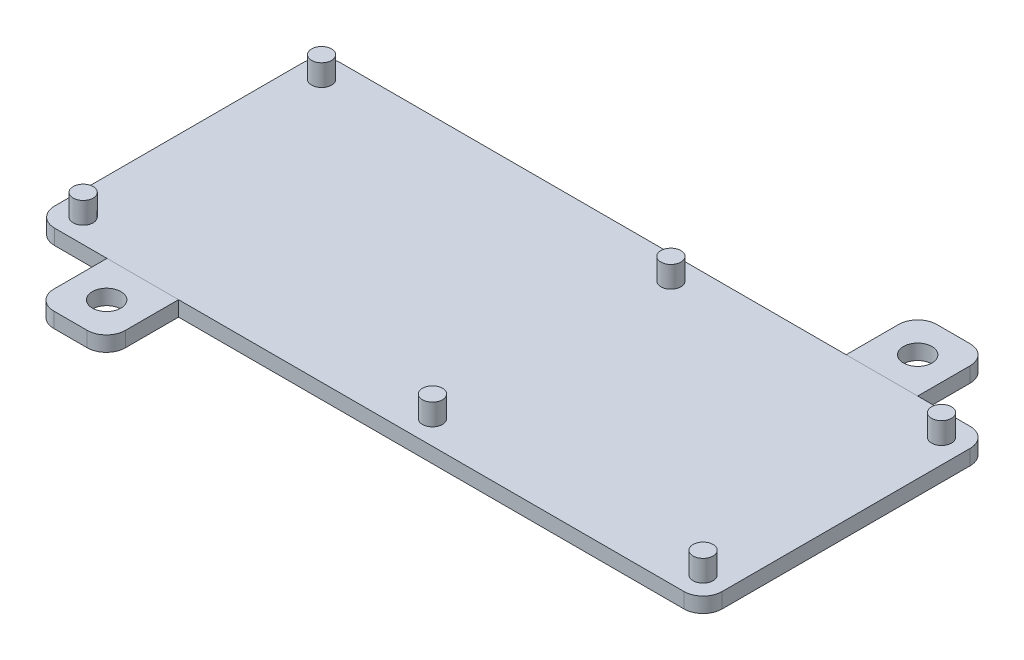
from build123d import *

# Parameters (mm, degrees)
SKETCH1_R             = 2.0955
BOSS_EXTRUDE1_DEPTH   = 4.5
BOSS_EXTRUDE1_2_DEPTH = 4.5
BOSS_EXTRUDE1_3_DEPTH = 4.5
BOSS_EXTRUDE1_4_DEPTH = 4.5
BOSS_EXTRUDE1_5_DEPTH = 4.5
BOSS_EXTRUDE1_6_DEPTH = 4.5
SKETCH2_W             = 140
SKETCH2_H             = 60
BOSS_EXTRUDE2_DEPTH   = 3.175
FILLET1_R             = 4
SKETCH3_W             = 15
SKETCH3_H             = 15.144108324
SKETCH3_R             = 3
BOSS_EXTRUDE3_DEPTH   = 3.175
SKETCH3_H_2           = 15
BOSS_EXTRUDE3_2_DEPTH = 3.175
FILLET2_R             = 4
FILLET3_R             = 4


with BuildPart() as part:
    # Sketch1 → Boss-Extrude1 (new body)
    with BuildSketch(Plane.XZ.offset(38.063324544)):
        with Locations(Location((-181.839905385, -5.726884341, 0), (0, 0, 270))):
            Circle(SKETCH1_R)
    extrude(amount=BOSS_EXTRUDE1_DEPTH)



with BuildPart() as body_2:
    # Sketch1 → Boss-Extrude1 2 (new body)
    with BuildSketch(Plane.XZ.offset(38.063324544)):
        with Locations(Location((-108.589905385, -5.726884341, 0), (0, 0, 270))):
            Circle(SKETCH1_R)
    extrude(amount=BOSS_EXTRUDE1_2_DEPTH)


with BuildPart() as body_3:
    # Sketch1 → Boss-Extrude1 3 (new body)
    with BuildSketch(Plane.XZ.offset(38.063324544)):
        with Locations(Location((-51.839905385, -5.726884341, 0), (0, 0, 270))):
            Circle(SKETCH1_R)
    extrude(amount=BOSS_EXTRUDE1_3_DEPTH)


with BuildPart() as body_4:
    # Sketch1 → Boss-Extrude1 4 (new body)
    with BuildSketch(Plane.XZ.offset(38.063324544)):
        with Locations(Location((-51.839905385, 44.273115659, 0), (0, 0, 270))):
            Circle(SKETCH1_R)
    extrude(amount=BOSS_EXTRUDE1_4_DEPTH)


with BuildPart() as body_5:
    # Sketch1 → Boss-Extrude1 5 (new body)
    with BuildSketch(Plane.XZ.offset(38.063324544)):
        with Locations(Location((-108.589905385, 44.273115659, 0), (0, 0, 270))):
            Circle(SKETCH1_R)
    extrude(amount=BOSS_EXTRUDE1_5_DEPTH)


with BuildPart() as body_6:
    # Sketch1 → Boss-Extrude1 6 (new body)
    with BuildSketch(Plane.XZ.offset(38.063324544)):
        with Locations(Location((-181.839905385, 44.273115659, 0), (0, 0, 270))):
            Circle(SKETCH1_R)
    extrude(amount=BOSS_EXTRUDE1_6_DEPTH)


with BuildPart() as part_1:
    add(part.part)

    add(body_2.part)  # Boss-Extrude2 merges body 2

    add(body_3.part)  # Boss-Extrude2 merges body 3

    add(body_4.part)  # Boss-Extrude2 merges body 4

    add(body_5.part)  # Boss-Extrude2 merges body 5

    add(body_6.part)  # Boss-Extrude2 merges body 6
    # Sketch2 → Boss-Extrude2 (add)
    with BuildSketch(Plane.XZ.offset(42.563324544)):
        with Locations((-116.839905385, 19.273115659)):
            Rectangle(SKETCH2_W, SKETCH2_H)
    extrude(amount=BOSS_EXTRUDE2_DEPTH)

    # Fillet1
    fillet1_edges = [part_1.edges().sort_by_distance(p)[0] for p in [
        (-46.839905385, -44.150824544, -10.726884341),
        (-46.839905385, -44.150824544, 49.273115659),
        (-186.839905385, -44.150824544, 49.273115659),
        (-186.839905385, -44.150824544, -10.726884341),
    ]]
    fillet(fillet1_edges, radius=FILLET1_R)


with BuildPart() as body_2_2:
    # Sketch3 → Boss-Extrude3 (new body)
    with BuildSketch(Plane.XZ.offset(45.738324544)):
        with Locations((-164.339905385, 56.845169821)):
            Rectangle(SKETCH3_W, SKETCH3_H)
        with Locations(Location((-164.339905385, 56.845169821, 0), (0, 0, 270))):
            Circle(SKETCH3_R, mode=Mode.SUBTRACT)
    extrude(amount=-BOSS_EXTRUDE3_DEPTH)

    # Fillet2
    fillet2_edges = [body_2_2.edges().sort_by_distance(p)[0] for p in [
        (-171.839905385, -44.150824544, 64.417223983),
        (-156.839905385, -44.150824544, 64.417223983),
    ]]
    fillet(fillet2_edges, radius=FILLET2_R)


with BuildPart() as body_3_2:
    # Sketch3 → Boss-Extrude3 2 (new body)
    with BuildSketch(Plane.XZ.offset(45.738324544)):
        with Locations((-69.339905385, -18.226884341)):
            Rectangle(SKETCH3_W, SKETCH3_H_2)
        with Locations(Location((-69.339905385, -18.226884341, 0), (0, 0, 270))):
            Circle(SKETCH3_R, mode=Mode.SUBTRACT)
    extrude(amount=-BOSS_EXTRUDE3_2_DEPTH)

    # Fillet3
    fillet3_edges = [body_3_2.edges().sort_by_distance(p)[0] for p in [
        (-76.839905385, -44.150824544, -25.726884341),
        (-61.839905385, -44.150824544, -25.726884341),
    ]]
    fillet(fillet3_edges, radius=FILLET3_R)


solid = Compound([part_1.part, body_2_2.part, body_3_2.part])
